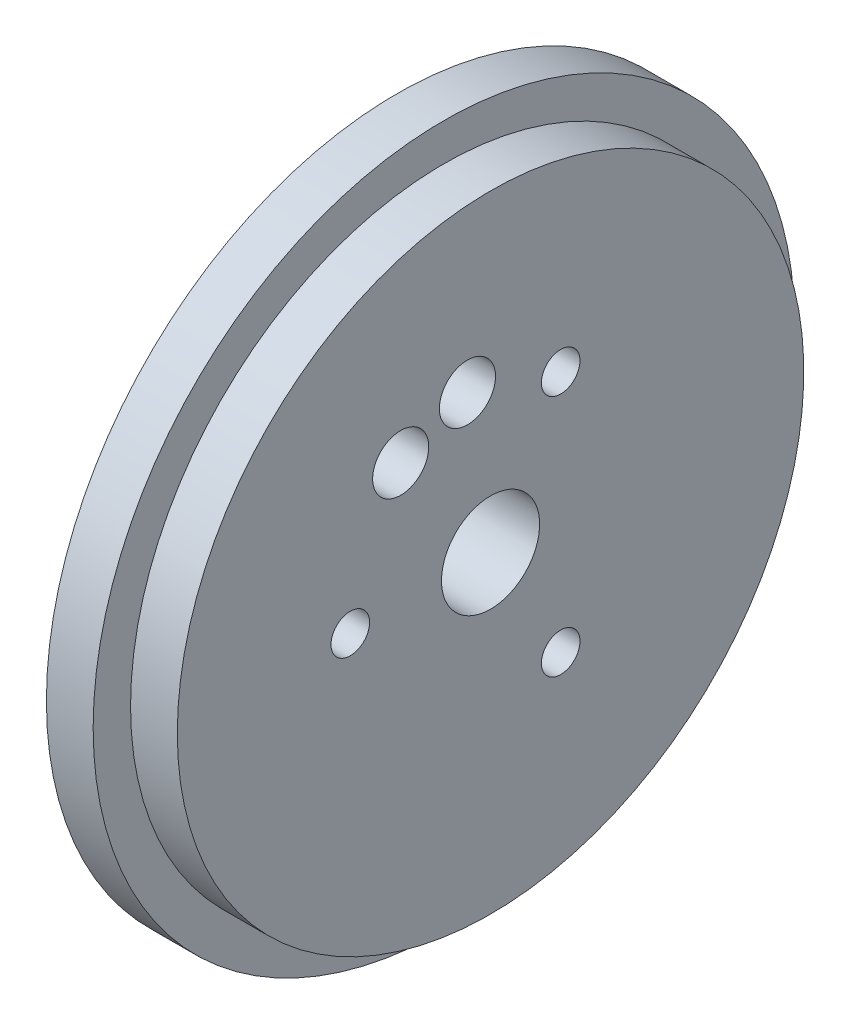
from build123d import *

# Parameters (mm, degrees)
AXIAL_HOLES_DEPTH      = 150.832206151
AXIAL_HOLES_DEPTH_BACK = 150.832206151
SKETCH2_R              = 2.4
SKETCH2_R_2            = 1.65


with BuildPart() as part:
    # Axial profile (mm) → Full revolution (revolve)
    with BuildSketch(Plane.XY, mode=Mode.PRIVATE) as full_revolution_sk:
        Polygon((135.7, 4.2), (143.7, 4.2), (143.7, 26.8), (139.7, 26.8), (139.7, 30), (135.7, 30), align=None)
    revolve(full_revolution_sk.sketch.rotate(Axis((-110, 0, 0), (1, 0, 0)), 90), axis=Axis((-110, 0, 0), (1, 0, 0)))

    # Sketch2 → Axial holes (cut, two sides: drawn at the far end of the back side and taken through both)
    with BuildSketch(Plane(origin=(0, 0, 0), x_dir=(0, 0, -1), z_dir=(1, 0, 0)).offset(-AXIAL_HOLES_DEPTH_BACK)):
        with Locations((-1.977382665, 12.848733704)):
            Circle(SKETCH2_R)
        with Locations((-7.687206041, 10.483647423)):
            Circle(SKETCH2_R)
        with Locations((-12, 0)):
            Circle(SKETCH2_R_2)
        with Locations((6, -10.392304845)):
            Circle(SKETCH2_R_2)
        with Locations((6, 10.392304845)):
            Circle(SKETCH2_R_2)
    extrude(amount=AXIAL_HOLES_DEPTH + AXIAL_HOLES_DEPTH_BACK, mode=Mode.SUBTRACT)


solid = part.part
